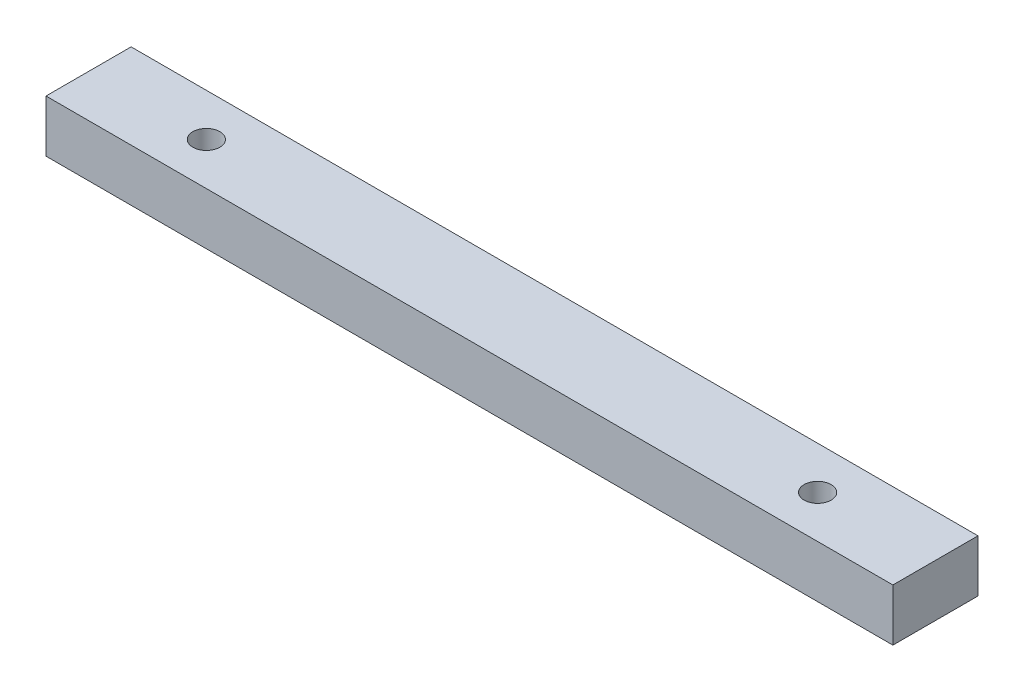
from build123d import *

# Parameters (mm, degrees)
SKETCH1_W           = 398
SKETCH1_H           = 24.5
BOSS_EXTRUDE1_DEPTH = 40
SKETCH4_R           = 6.35
CUT_EXTRUDE1_DEPTH  = 40


with BuildPart() as part:
    # Sketch1 → Boss-Extrude1 (new body)
    with BuildSketch(Plane.XY):
        with Locations((191.606828194, 2.482378855)):
            Rectangle(SKETCH1_W, SKETCH1_H)
    extrude(amount=BOSS_EXTRUDE1_DEPTH)

    # Sketch4 → Cut-Extrude1 (cut)
    with BuildSketch(Plane(origin=(0, 14.732378855, 0), x_dir=(1, 0, 0), z_dir=(0, 1, 0))):
        with Locations(Location((335.234828194, -20, 0), (0, 0, 180))):
            Circle(SKETCH4_R)
        with Locations(Location((47.978828194, -20, 0), (0, 0, 180))):
            Circle(SKETCH4_R)
    extrude(amount=-CUT_EXTRUDE1_DEPTH, mode=Mode.SUBTRACT)


solid = part.part
